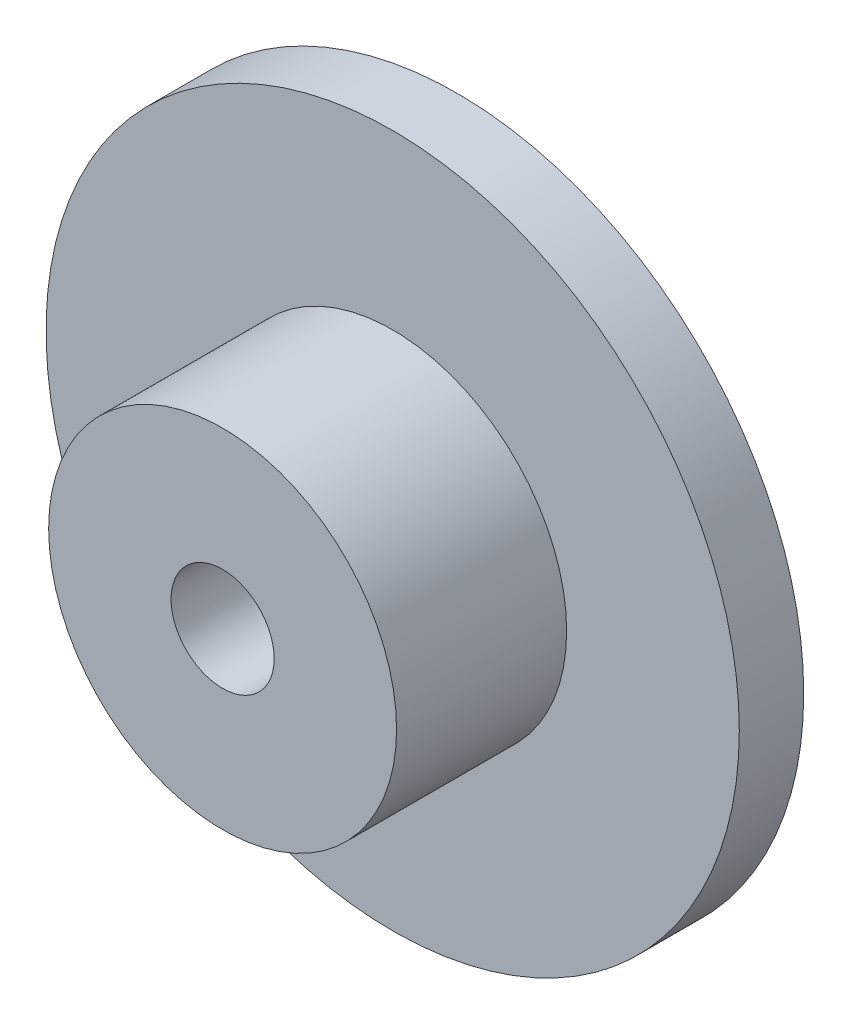
from build123d import *

# Parameters (mm, degrees)
SKETCH_1_R            = 6.725
SKETCH_1_R_2          = 1
EXTRUDE_T32_0_4_DEPTH = 1.25
SKETCH_2_R            = 3.375
SKETCH_2_R_2          = 1
EXTRUDE_T14_0_4_DEPTH = 3.3


with BuildPart() as part:
    # 草图1 → T32-0.4 (new body)
    with BuildSketch(Plane.XY):
        Circle(SKETCH_1_R)
        Circle(SKETCH_1_R_2, mode=Mode.SUBTRACT)
    extrude(amount=EXTRUDE_T32_0_4_DEPTH)

    # 草图2 → T14-0.4 (add)
    with BuildSketch(Plane.XY.offset(1.25)):
        Circle(SKETCH_2_R)
        Circle(SKETCH_2_R_2, mode=Mode.SUBTRACT)
    extrude(amount=EXTRUDE_T14_0_4_DEPTH)


solid = part.part
